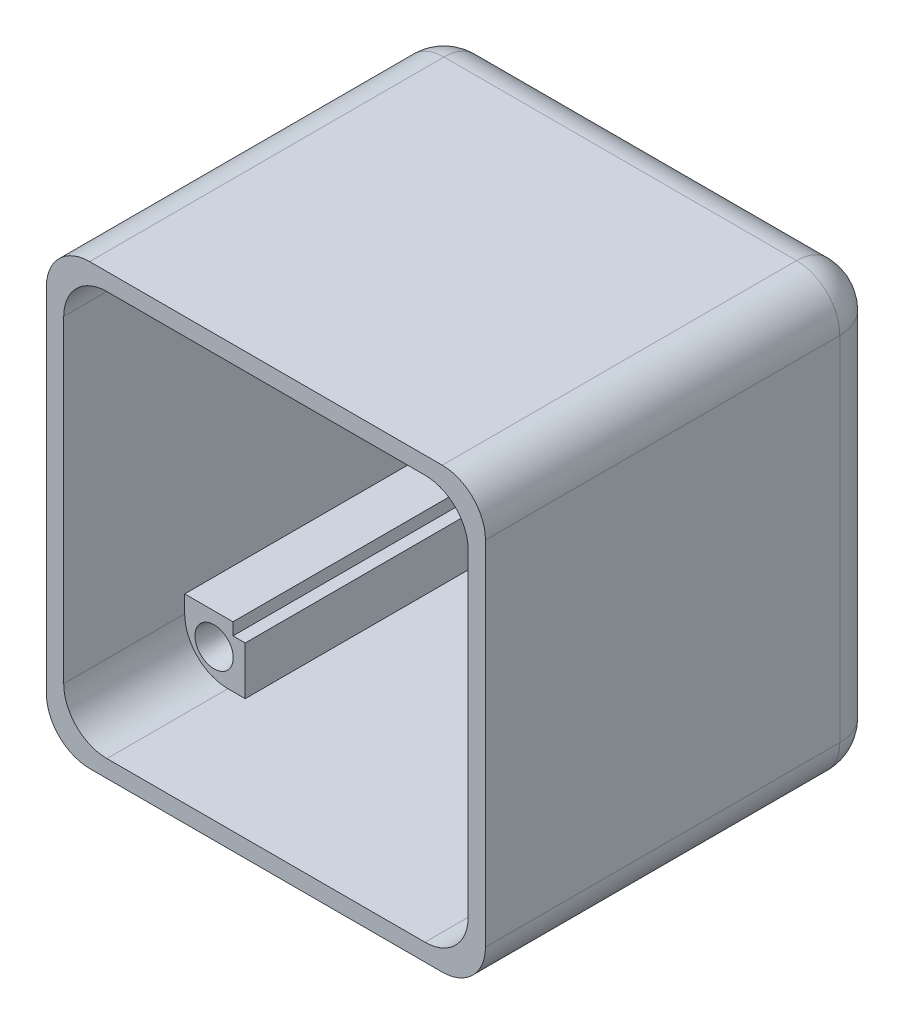
from build123d import *

# Parameters (mm, degrees)
BOSS_EXTRUDE1_DEPTH          = 29.21
SHELL1_T                     = -2.54
FILLET1_R                    = 6.35
BOSS_EXTRUDE2_DEPTH          = 38.1
SKETCH3_R                    = 2.8067
CUT_EXTRUDE1_DEPTH           = 4.7
CUT_EXTRUDE1_DRAFT           = -8
CUT_EXTRUDE1_PROFILE_2_DEPTH = 4.7
CUT_EXTRUDE1_PROFILE_2_DRAFT = -8
CUT_EXTRUDE1_PROFILE_3_DEPTH = 4.7
CUT_EXTRUDE1_PROFILE_3_DRAFT = -8
CUT_EXTRUDE1_PROFILE_4_DEPTH = 4.7
CUT_EXTRUDE1_PROFILE_4_DRAFT = -8
SKETCH5_W                    = 45.253999916
SKETCH5_H                    = 45.253999916
CUT_EXTRUDE5_DEPTH           = 38.1


with BuildPart() as part:
    # Sketch1 → Boss-Extrude1 (new, symmetric)
    with BuildSketch(Plane.XY):
        Polygon((-32.258, -32.258), (-32.258, -11.938), (-32.258, 11.938), (-32.258, 32.258), (32.258, 32.258), (32.258, -32.258), align=None)
    extrude(amount=BOSS_EXTRUDE1_DEPTH, both=True)

    # Shell1
    shell1_openings = [part.faces().sort_by_distance(p)[0] for p in [
        (0, 0, 29.21),
    ]]
    offset(amount=SHELL1_T, openings=shell1_openings, kind=Kind.INTERSECTION)

    # Fillet1
    fillet1_edges = [part.edges().sort_by_distance(p)[0] for p in [
        (-32.258, -32.258, 0),
        (-32.258, 32.258, 0),
        (32.258, 32.258, 0),
        (32.258, -32.258, 0),
        (-29.718, -29.718, 1.27),
        (29.718, -29.718, 1.27),
        (29.718, 29.718, 1.27),
        (-29.718, 29.718, 1.27),
        (-32.258, 0, -29.21),
        (0, 32.258, -29.21),
        (32.258, 0, -29.21),
        (0, -32.258, -29.21),
    ]]
    fillet(fillet1_edges, radius=FILLET1_R)

    # Sketch2 → Boss-Extrude2 (add)
    with BuildSketch(Plane.XY.offset(-26.67)):
        with BuildLine():
            Line((-20.828, -20.828), (-29.718, -20.828))
            Line((-29.718, -20.828), (-29.718, -23.368))
            ThreePointArc((-29.718, -23.368), (-27.858128061, -27.858128061), (-23.368, -29.718))
            Line((-23.368, -29.718), (-20.828, -29.718))
            Line((-20.828, -29.718), (-20.828, -20.828))
        make_face()
        with BuildLine():
            ThreePointArc((-29.718, 23.368), (-27.858128061, 27.858128061), (-23.368, 29.718))
            Line((-23.368, 29.718), (-20.828, 29.718))
            Line((-20.828, 29.718), (-20.828, 20.828))
            Line((-20.828, 20.828), (-29.718, 20.828))
            Line((-29.718, 20.828), (-29.718, 23.368))
        make_face()
        with BuildLine():
            ThreePointArc((29.718, 23.368), (27.858128061, 27.858128061), (23.368, 29.718))
            Line((23.368, 29.718), (20.828, 29.718))
            Line((20.828, 29.718), (20.828, 20.828))
            Line((20.828, 20.828), (29.718, 20.828))
            Line((29.718, 20.828), (29.718, 23.368))
        make_face()
        with BuildLine():
            ThreePointArc((23.368, -29.718), (27.858128061, -27.858128061), (29.718, -23.368))
            Line((29.718, -23.368), (29.718, -20.828))
            Line((29.718, -20.828), (20.828, -20.828))
            Line((20.828, -20.828), (20.828, -29.718))
            Line((20.828, -29.718), (23.368, -29.718))
        make_face()
    extrude(amount=BOSS_EXTRUDE2_DEPTH)


with BuildPart() as cut_extrude1_tool:
    # Sketch3 → Cut-Extrude1 (with draft: the straight prism first)
    with BuildSketch(Plane.XY.offset(11.43)):
        with Locations((-25.4, -25.4)):
            Circle(SKETCH3_R)
    extrude(amount=-CUT_EXTRUDE1_DEPTH)
    # Cut-Extrude1: the draft: its side faces are tilted about the plane it starts from
    cut_extrude1_sides = [cut_extrude1_tool.faces().sort_by_distance(p)[0] for p in [
        (-28.2067, -25.4, 9.08),
    ]]
    draft(cut_extrude1_sides, Plane.XY.offset(11.43), CUT_EXTRUDE1_DRAFT)


with BuildPart() as part_1:
    add(part.part)

    # Cut-Extrude1: cut by cut_extrude1_tool
    add(cut_extrude1_tool.part, mode=Mode.SUBTRACT)


with BuildPart() as cut_extrude1_profile_2_tool:
    # Sketch3 → Cut-Extrude1 profile 2 (with draft: the straight prism first)
    with BuildSketch(Plane.XY.offset(11.43)):
        with Locations((-25.4, 25.4)):
            Circle(SKETCH3_R)
    extrude(amount=-CUT_EXTRUDE1_PROFILE_2_DEPTH)
    # Cut-Extrude1 profile 2: the draft: its side faces are tilted about the plane it starts from
    cut_extrude1_profile_2_sides = [cut_extrude1_profile_2_tool.faces().sort_by_distance(p)[0] for p in [
        (-28.2067, 25.4, 9.08),
    ]]
    draft(cut_extrude1_profile_2_sides, Plane.XY.offset(11.43), CUT_EXTRUDE1_PROFILE_2_DRAFT)


with BuildPart() as part_2:
    add(part_1.part)

    # Cut-Extrude1 profile 2: cut by cut_extrude1_profile_2_tool
    add(cut_extrude1_profile_2_tool.part, mode=Mode.SUBTRACT)


with BuildPart() as cut_extrude1_profile_3_tool:
    # Sketch3 → Cut-Extrude1 profile 3 (with draft: the straight prism first)
    with BuildSketch(Plane.XY.offset(11.43)):
        with Locations((25.4, 25.4)):
            Circle(SKETCH3_R)
    extrude(amount=-CUT_EXTRUDE1_PROFILE_3_DEPTH)
    # Cut-Extrude1 profile 3: the draft: its side faces are tilted about the plane it starts from
    cut_extrude1_profile_3_sides = [cut_extrude1_profile_3_tool.faces().sort_by_distance(p)[0] for p in [
        (22.5933, 25.4, 9.08),
    ]]
    draft(cut_extrude1_profile_3_sides, Plane.XY.offset(11.43), CUT_EXTRUDE1_PROFILE_3_DRAFT)


with BuildPart() as part_3:
    add(part_2.part)

    # Cut-Extrude1 profile 3: cut by cut_extrude1_profile_3_tool
    add(cut_extrude1_profile_3_tool.part, mode=Mode.SUBTRACT)


with BuildPart() as cut_extrude1_profile_4_tool:
    # Sketch3 → Cut-Extrude1 profile 4 (with draft: the straight prism first)
    with BuildSketch(Plane.XY.offset(11.43)):
        with Locations((25.4, -25.4)):
            Circle(SKETCH3_R)
    extrude(amount=-CUT_EXTRUDE1_PROFILE_4_DEPTH)
    # Cut-Extrude1 profile 4: the draft: its side faces are tilted about the plane it starts from
    cut_extrude1_profile_4_sides = [cut_extrude1_profile_4_tool.faces().sort_by_distance(p)[0] for p in [
        (22.5933, -25.4, 9.08),
    ]]
    draft(cut_extrude1_profile_4_sides, Plane.XY.offset(11.43), CUT_EXTRUDE1_PROFILE_4_DRAFT)


with BuildPart() as part_4:
    add(part_3.part)

    # Cut-Extrude1 profile 4: cut by cut_extrude1_profile_4_tool
    add(cut_extrude1_profile_4_tool.part, mode=Mode.SUBTRACT)

    # Sketch5 → Cut-Extrude5 (cut)
    with BuildSketch(Plane.XY.offset(11.43)):
        Rectangle(SKETCH5_W, SKETCH5_H)
    extrude(amount=-CUT_EXTRUDE5_DEPTH, mode=Mode.SUBTRACT)


solid = part_4.part
